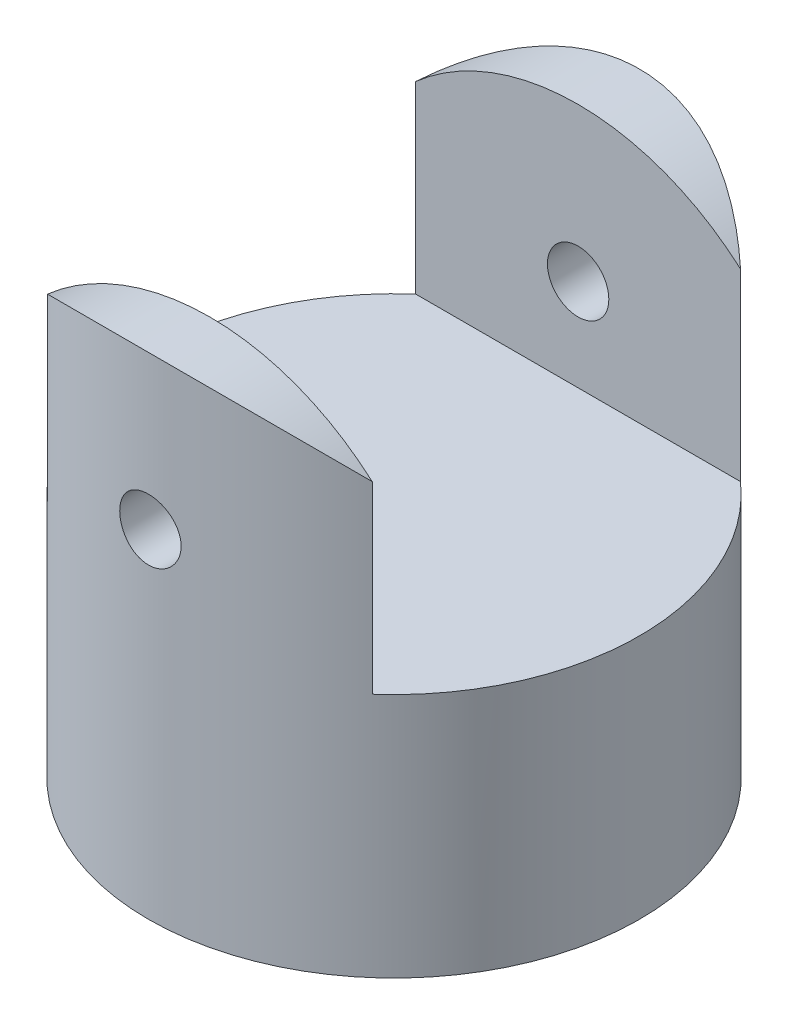
from build123d import *

# Parameters (mm, degrees)
SKETCH1_R               = 50.8
BOSS_EXTRUDE1_DEPTH     = 101.6
CUT_EXTRUDE1_DEPTH      = 96.52
CUT_EXTRUDE1_DEPTH_BACK = 101.6
SKETCH2_R               = 6.35
CUT_EXTRUDE2_DEPTH      = 103.886
CUT_EXTRUDE2_DEPTH_BACK = 86.36
SKETCH3_W               = 76.2
SKETCH3_H               = 82.476489684


with BuildPart() as part:
    # Sketch1 → Boss-Extrude1 (new body)
    with BuildSketch(Plane(origin=(0, 0, 0), x_dir=(1, 0, 0), z_dir=(0, 1, 0))):
        with Locations(Location((0, 0, 0), (0, 0, 270))):
            Circle(SKETCH1_R)
    extrude(amount=BOSS_EXTRUDE1_DEPTH)

    # Sketch2 → Cut-Extrude1 (cut, two sides: drawn at the far end of the back side and taken through both)
    with BuildSketch(Plane.XY.offset(-CUT_EXTRUDE1_DEPTH_BACK)):
        with Locations(Location((0, 69.85, 0), (0, 0, 180))):
            Circle(SKETCH2_R)
        with BuildLine():
            Line((-50.8, 50.8), (-71.743329605, 50.8))
            Line((-71.743329605, 50.8), (-71.743329605, 136.317810242))
            Line((-71.743329605, 136.317810242), (67.424530317, 136.317810242))
            Line((67.424530317, 136.317810242), (67.424530317, 50.8))
            Line((67.424530317, 50.8), (50.8, 50.8))
            ThreePointArc((50.8, 50.8), (0, 101.6), (-50.8, 50.8))
        make_face()
    extrude(amount=CUT_EXTRUDE1_DEPTH + CUT_EXTRUDE1_DEPTH_BACK, mode=Mode.SUBTRACT)

    # Sketch3 → Cut-Extrude2 (cut, two sides: drawn at the far end of the back side and taken through both)
    with BuildSketch(Plane(origin=(0, 0, 0), x_dir=(0, 0, -1), z_dir=(1, 0, 0)).offset(-CUT_EXTRUDE2_DEPTH_BACK)):
        with Locations((0, 92.038244842)):
            Rectangle(SKETCH3_W, SKETCH3_H)
    extrude(amount=CUT_EXTRUDE2_DEPTH + CUT_EXTRUDE2_DEPTH_BACK, mode=Mode.SUBTRACT)


solid = part.part
